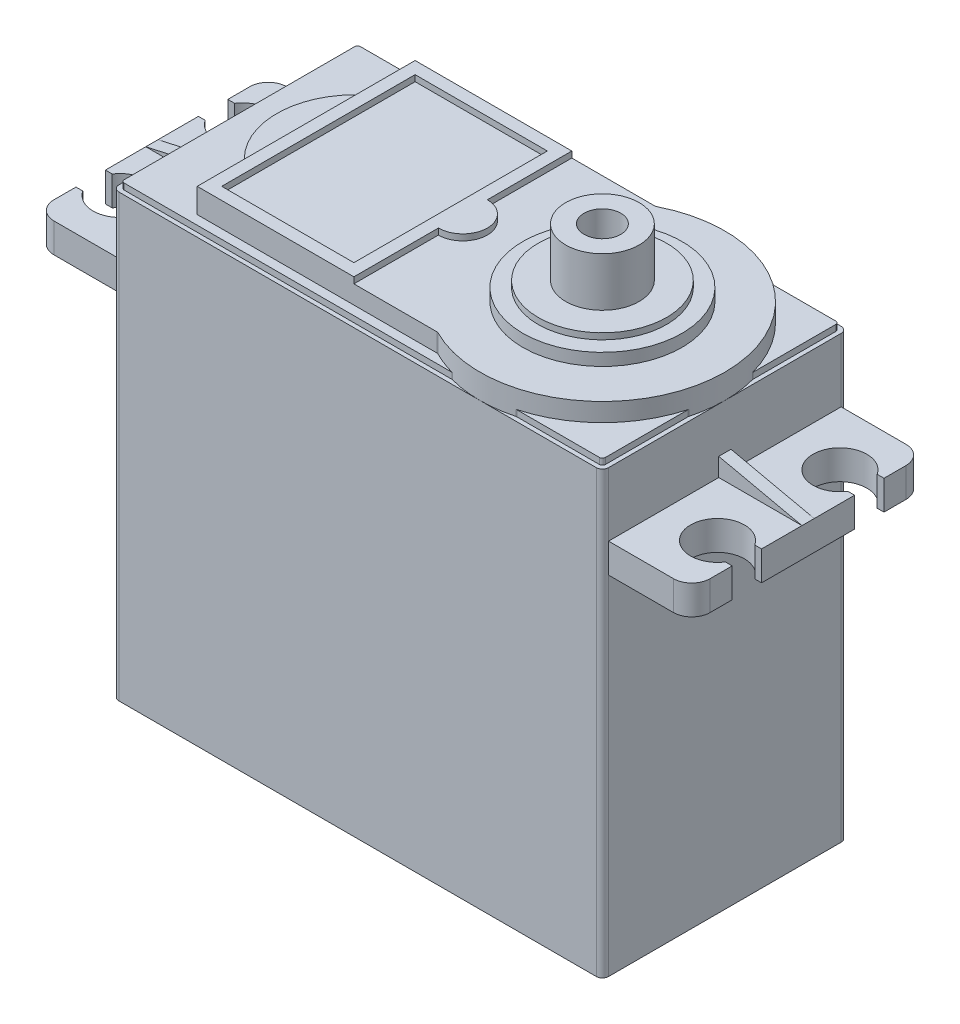
from build123d import *

# Parameters (mm, degrees)
SKETCH1_W                 = 40
SKETCH1_H                 = 20
BOSS_EXTRUDE1_DEPTH       = 38
BOSS_EXTRUDE2_DEPTH       = 2
BOSS_EXTRUDE3_DEPTH       = 0.5
SKETCH6_W                 = 12.8
SKETCH6_H                 = 17.8
SKETCH6_W_2               = 10.8
SKETCH6_H_2               = 15.8
BOSS_EXTRUDE4_DEPTH       = 0.5
BOSS_EXTRUDE5_DEPTH       = 0.5
SKETCH8_R                 = 6.5
BOSS_EXTRUDE6_DEPTH       = 1
SKETCH9_R                 = 5.25
BOSS_EXTRUDE7_DEPTH       = 0.5
SKETCH10_R                = 3
BOSS_EXTRUDE8_DEPTH       = 4
SKETCH11_R                = 1.5
CUT_EXTRUDE1_DEPTH        = 10
CHAMFER1_SIZE             = 2
SKETCH12_R                = 2
CUT_EXTRUDE2_DEPTH        = 2
FILLET1_R                 = 0.5
FILLET2_R                 = 0.25
BOSS_EXTRUDE9_DEPTH       = 2.4
BOSS_EXTRUDE10_DEPTH      = 0.5
BOSS_EXTRUDE10_DEPTH_BACK = 0.5
FILLET3_R                 = 1.5


with BuildPart() as part:
    # Sketch1 → Boss-Extrude1 (new body)
    with BuildSketch(Plane(origin=(0, 0, 0), x_dir=(1, 0, 0), z_dir=(0, 1, 0))):
        Rectangle(SKETCH1_W, SKETCH1_H)
    extrude(amount=BOSS_EXTRUDE1_DEPTH)

    # Sketch2 → Boss-Extrude2 (add)
    with BuildSketch(Plane(origin=(0, 38, 0), x_dir=(1, 0, 0), z_dir=(0, 1, 0))):
        with BuildLine():
            ThreePointArc((-3.783333333, 0), (-7.418581742, 5.77726026), (-14.2, 5))
            Line((-14.2, 5), (-14.2, -5))
            ThreePointArc((-14.2, -5), (-7.418581742, -5.77726026), (-3.783333333, 0))
        make_face()
        with BuildLine():
            Line((-14.2, -5), (-14.2, 5))
            ThreePointArc((-14.2, 5), (-16.6, 0), (-14.2, -5))
        make_face()
        with BuildLine():
            Line((5.440394754, 8.9), (-14.2, 8.9))
            Line((-14.2, 8.9), (-14.2, 5))
            ThreePointArc((-14.2, 5), (-7.418581742, 5.77726026), (-3.783333333, 0))
            ThreePointArc((-3.783333333, 0), (-7.418581742, -5.77726026), (-14.2, -5))
            Line((-14.2, -5), (-14.2, -8.9))
            Line((-14.2, -8.9), (5.440394754, -8.9))
            ThreePointArc((5.440394754, -8.9), (0, 0), (5.440394754, 8.9))
        make_face()
        with BuildLine():
            ThreePointArc((20, 0), (15.215551147, 8.532175938), (5.440394754, 8.9))
            Line((5.440394754, 8.9), (5.440394754, -8.9))
            ThreePointArc((5.440394754, -8.9), (15.215551147, -8.532175938), (20, 0))
        make_face()
        with BuildLine():
            Line((5.440394754, -8.9), (5.440394754, 8.9))
            ThreePointArc((5.440394754, 8.9), (0, 0), (5.440394754, -8.9))
        make_face()
    extrude(amount=BOSS_EXTRUDE2_DEPTH)

    # Sketch3 → Boss-Extrude3 (add)
    with BuildSketch(Plane(origin=(0, 38, 0), x_dir=(1, 0, 0), z_dir=(0, 1, 0))):
        Polygon((-19.65, 9.65), (10, 9.65), (19.65, 9.65), (19.65, 0), (19.65, -9.65), (10, -9.65), (-19.65, -9.65), align=None)
    extrude(amount=BOSS_EXTRUDE3_DEPTH)

    # Sketch6 → Boss-Extrude4 (add)
    with BuildSketch(Plane(origin=(0, 40, 0), x_dir=(1, 0, 0), z_dir=(0, 1, 0))):
        with Locations((-7.8, 0)):
            Rectangle(SKETCH6_W, SKETCH6_H)
        with Locations((-7.8, 0)):
            Rectangle(SKETCH6_W_2, SKETCH6_H_2, mode=Mode.SUBTRACT)
    extrude(amount=BOSS_EXTRUDE4_DEPTH)

    # Sketch7 → Boss-Extrude5 (add)
    with BuildSketch(Plane(origin=(0, 40, 0), x_dir=(1, 0, 0), z_dir=(0, 1, 0))):
        with BuildLine():
            ThreePointArc((0.6, 0), (0.014213562, 1.414213562), (-1.4, 2))
            Line((-1.4, 2), (-1.4, -2))
            ThreePointArc((-1.4, -2), (0.014213562, -1.414213562), (0.6, 0))
        make_face()
    extrude(amount=BOSS_EXTRUDE5_DEPTH)

    # Sketch8 → Boss-Extrude6 (add)
    with BuildSketch(Plane(origin=(0, 40, 0), x_dir=(1, 0, 0), z_dir=(0, 1, 0))):
        with Locations(Location((10, 0, 0), (0, 0, 270))):
            Circle(SKETCH8_R)
    extrude(amount=BOSS_EXTRUDE6_DEPTH)

    # Sketch9 → Boss-Extrude7 (add)
    with BuildSketch(Plane(origin=(0, 41, 0), x_dir=(1, 0, 0), z_dir=(0, 1, 0))):
        with Locations(Location((10, 0, 0), (0, 0, 270))):
            Circle(SKETCH9_R)
    extrude(amount=BOSS_EXTRUDE7_DEPTH)

    # Sketch10 → Boss-Extrude8 (add)
    with BuildSketch(Plane(origin=(0, 41.5, 0), x_dir=(1, 0, 0), z_dir=(0, 1, 0))):
        with Locations(Location((10, 0, 0), (0, 0, 270))):
            Circle(SKETCH10_R)
    extrude(amount=BOSS_EXTRUDE8_DEPTH)

    # Sketch11 → Cut-Extrude1 (cut)
    with BuildSketch(Plane(origin=(0, 45.5, 0), x_dir=(1, 0, 0), z_dir=(0, 1, 0))):
        with Locations(Location((10, 0, 0), (0, 0, 270))):
            Circle(SKETCH11_R)
    extrude(amount=-CUT_EXTRUDE1_DEPTH, mode=Mode.SUBTRACT)

    # Chamfer1
    chamfer1_edges = [part.edges().sort_by_distance(p)[0] for p in [
        (-20, 0, 0),
        (0, 0, 10),
        (20, 0, 0),
        (0, 0, -10),
    ]]
    chamfer(chamfer1_edges, length=CHAMFER1_SIZE)

    # Sketch12 → Cut-Extrude2 (cut)
    with BuildSketch(Plane.XZ):
        with Locations((19, 9)):
            Circle(SKETCH12_R)
        with Locations((-19, 9)):
            Circle(SKETCH12_R)
        with Locations((19, -9)):
            Circle(SKETCH12_R)
        with Locations((-19, -9)):
            Circle(SKETCH12_R)
    extrude(amount=-CUT_EXTRUDE2_DEPTH, mode=Mode.SUBTRACT)

    # Fillet1
    fillet1_edges = [part.edges().sort_by_distance(p)[0] for p in [
        (-20, 20, -10),
        (-20, 20, 10),
        (20, 20, 10),
        (20, 20, -10),
    ]]
    fillet(fillet1_edges, radius=FILLET1_R)

    # Fillet2
    fillet2_edges = [part.edges().sort_by_distance(p)[0] for p in [
        (5.440394754, 39.25, 8.9),
        (5.440394754, 39.25, -8.9),
        (7.377501192, 38.25, 9.65),
        (7.377501192, 38.25, -9.65),
        (12.622498808, 38.25, -9.65),
        (19.65, 38.25, -2.622498808),
        (19.65, 38.25, 2.622498808),
        (12.622498808, 38.25, 9.65),
        (-19.65, 38.25, 9.65),
        (19.65, 38.25, 9.65),
        (19.65, 38.25, -9.65),
        (-19.65, 38.25, -9.65),
    ]]
    fillet(fillet2_edges, radius=FILLET2_R)

    # Sketch13 → Boss-Extrude9 (add)
    with BuildSketch(Plane(origin=(0, 32.8, 0), x_dir=(1, 0, 0), z_dir=(0, 1, 0))):
        with BuildLine():
            Line((-20, -9.5), (-20, 9.5))
            Line((-20, 9.5), (-26.8, 9.5))
            Line((-26.8, 9.5), (-26.8, 6.2))
            Line((-26.8, 6.2), (-26.243908891, 6.2))
            ThreePointArc((-26.243908891, 6.2), (-23.774140416, 7.109099282), (-22.2, 5))
            ThreePointArc((-22.2, 5), (-23.774140416, 2.890900718), (-26.243908891, 3.8))
            Line((-26.243908891, 3.8), (-26.8, 3.8))
            Line((-26.8, 3.8), (-26.8, -3.8))
            Line((-26.8, -3.8), (-26.243908891, -3.8))
            ThreePointArc((-26.243908891, -3.8), (-23.774140416, -2.890900718), (-22.2, -5))
            ThreePointArc((-22.2, -5), (-23.774140416, -7.109099282), (-26.243908891, -6.2))
            Line((-26.243908891, -6.2), (-26.8, -6.2))
            Line((-26.8, -6.2), (-26.8, -9.5))
            Line((-26.8, -9.5), (-20, -9.5))
        make_face()
        with BuildLine():
            Line((26.243908891, 6.2), (26.8, 6.2))
            Line((26.8, 6.2), (26.8, 9.5))
            Line((26.8, 9.5), (20, 9.5))
            Line((20, 9.5), (20, -9.5))
            Line((20, -9.5), (26.8, -9.5))
            Line((26.8, -9.5), (26.8, -6.2))
            Line((26.8, -6.2), (26.243908891, -6.2))
            ThreePointArc((26.243908891, -6.2), (22.2, -5), (26.243908891, -3.8))
            Line((26.243908891, -3.8), (26.8, -3.8))
            Line((26.8, -3.8), (26.8, 3.8))
            Line((26.8, 3.8), (26.243908891, 3.8))
            ThreePointArc((26.243908891, 3.8), (22.2, 5), (26.243908891, 6.2))
        make_face()
    extrude(amount=-BOSS_EXTRUDE9_DEPTH)

    # Sketch14 → Boss-Extrude10 (add, two sides: drawn at the far end of the back side and taken through both)
    with BuildSketch(Plane.XY.offset(-BOSS_EXTRUDE10_DEPTH_BACK)):
        Polygon((-26.8, 32.8), (-20, 32.8), (-20, 34.3), align=None)
        Polygon((20, 32.8), (20, 34.3), (26.8, 32.8), align=None)
    extrude(amount=BOSS_EXTRUDE10_DEPTH + BOSS_EXTRUDE10_DEPTH_BACK)

    # Fillet3
    fillet3_edges = [part.edges().sort_by_distance(p)[0] for p in [
        (-26.8, 31.6, -9.5),
        (-26.8, 31.6, 9.5),
        (26.8, 31.6, 9.5),
        (26.8, 31.6, -9.5),
    ]]
    fillet(fillet3_edges, radius=FILLET3_R)


solid = part.part
